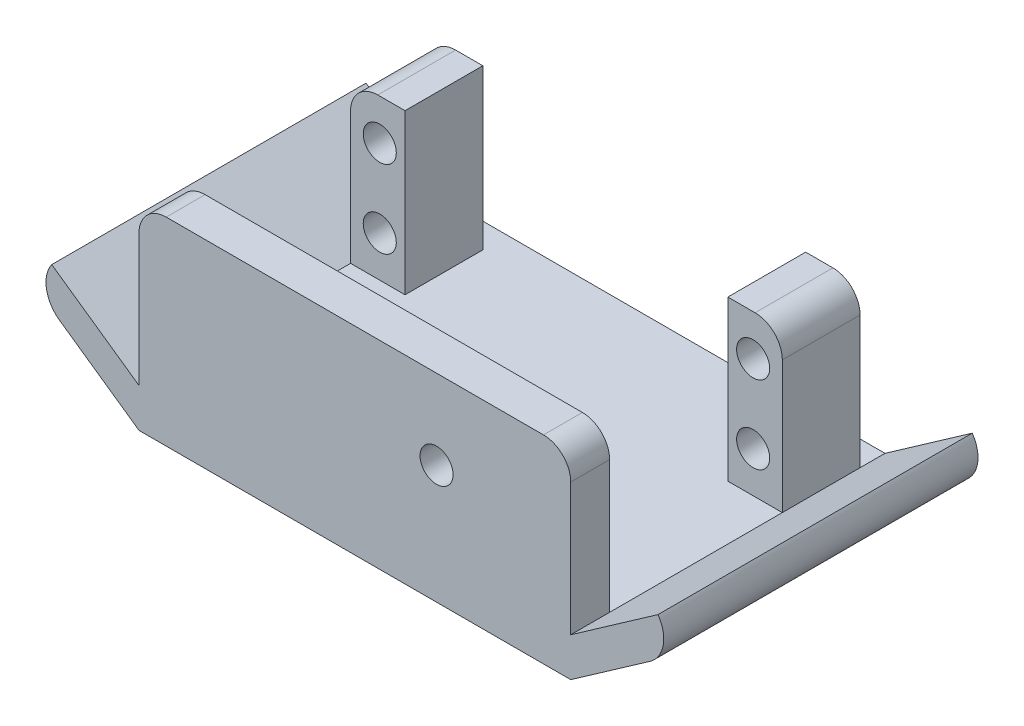
from build123d import *

# Parameters (mm, degrees)
SKETCH1_W            = 55.5
SKETCH1_H            = 40.4
BASE_DEPTH           = 5
SKETCH2_W            = 55.5
SKETCH2_H            = 25.5
WALL_DEPTH           = 5
SKETCH3_W            = 7
SKETCH3_H            = 20.5
MOUNTINGTABS_DEPTH   = 5
LIPS_REACH           = 75.23
SKETCH5_R            = 2.125
MOUNTINGHOLES_DEPTH  = 5
FILLETS_R            = 3.5
SKETCH6_R            = 2.125
THROUGHHOLE_DEPTH    = 5
FILLETS_OF_MIRROR3_R = 3.5
SKETCH7_W            = 104.516790574
SKETCH7_H            = 66.327963249
CUT_EXTRUDE1_DEPTH   = 73
SKETCH8_R            = 2.125
BOSS_EXTRUDE1_DEPTH  = 5


with BuildPart() as part:
    # Sketch1 → base (new body)
    with BuildSketch(Plane(origin=(0, 0, 0), x_dir=(1, 0, 0), z_dir=(0, 1, 0))):
        with Locations((27.75, 20.2)):
            Rectangle(SKETCH1_W, SKETCH1_H)
    base = extrude(amount=BASE_DEPTH)

    # Sketch2 → wall (add)
    with BuildSketch(Plane(origin=(0, 0, -40.4), x_dir=(-1, 0, 0), z_dir=(0, 0, -1))):
        with Locations((-27.75, 12.75)):
            Rectangle(SKETCH2_W, SKETCH2_H)
    wall = extrude(amount=-WALL_DEPTH)

    # Sketch3 → mountingTabs (add)
    with BuildSketch(Plane.XY.offset(-8.2)):
        with Locations((3.5, 15.25)):
            Rectangle(SKETCH3_W, SKETCH3_H)
        with Locations((52, 15.25)):
            Rectangle(SKETCH3_W, SKETCH3_H)
    mountingtabs = extrude(amount=MOUNTINGTABS_DEPTH)

    # lips: up to this face of the body (flat: up to its plane)
    lips_end = Plane(part.part.faces().sort_by_distance((27.75, 12.75, -40.4))[0])
    # Sketch4 → lips (add, up to the picked face)
    with BuildSketch(Plane.XY, mode=Mode.PRIVATE) as lips_sk1:
        with BuildLine():
            Line((0, 0), (-10.208884478, 7.148337868))
            ThreePointArc((-10.208884478, 7.148337868), (-11.894564223, 9.792816133), (-11.218174515, 12.85505036))
            Line((-11.218174515, 12.85505036), (0, 5))
            Line((0, 5), (0, 0))
        make_face()
    lips_tool1 = split(extrude(lips_sk1.sketch, amount=-LIPS_REACH, mode=Mode.PRIVATE), bisect_by=lips_end, keep=Keep.BOTH, mode=Mode.PRIVATE)
    # Sketch4 → lips (add, up to the picked face)
    with BuildSketch(Plane.XY, mode=Mode.PRIVATE) as lips_sk2:
        with BuildLine():
            Line((55.5, 5), (66.718174515, 12.85505036))
            ThreePointArc((66.718174515, 12.85505036), (67.394564223, 9.792816133), (65.708884478, 7.148337868))
            Line((65.708884478, 7.148337868), (55.5, 0))
            Line((55.5, 0), (55.5, 5))
        make_face()
    lips_tool2 = split(extrude(lips_sk2.sketch, amount=-LIPS_REACH, mode=Mode.PRIVATE), bisect_by=lips_end, keep=Keep.BOTH, mode=Mode.PRIVATE)
    lips_1 = lips_tool1.solids().sort_by(Axis((-5.839287, 6.590277, 0), (0, 0, -1)))[0]
    add(lips_1)
    lips_2 = lips_tool2.solids().sort_by(Axis((61.339287, 6.590277, 0), (0, 0, -1)))[0]
    add(lips_2)
    lips = lips_1 + lips_2  # lips as one shape, for the pattern or mirror that repeats it

    # Sketch5 → mountingHoles (cut)
    with BuildSketch(Plane.XY.offset(-3.2)):
        with Locations((3.75, 20.25)):
            Circle(SKETCH5_R)
        with Locations(Location((3.75, 10.25, 0), (0, 0, 180))):
            Circle(SKETCH5_R)
        with Locations((51.75, 10.25)):
            Circle(SKETCH5_R)
        with Locations(Location((51.75, 20.25, 0), (0, 0, 180))):
            Circle(SKETCH5_R)
    mountingholes = extrude(amount=-MOUNTINGHOLES_DEPTH, mode=Mode.SUBTRACT)

    # fillets
    fillets_edges = [part.edges().sort_by_distance(p)[0] for p in [
        (0, 25.5, -37.9),
        (55.5, 25.5, -37.9),
        (0, 25.5, -5.7),
        (55.5, 25.5, -5.7),
    ]]
    fillet(fillets_edges, radius=FILLETS_R)

    # Sketch6 → throughHole (cut)
    with BuildSketch(Plane.XY.offset(-35.4)):
        with Locations((38.25, 15.25)):
            Circle(SKETCH6_R)
    throughhole = extrude(amount=-THROUGHHOLE_DEPTH, mode=Mode.SUBTRACT)

    # Mirror3: base, wall, mountingTabs, lips, mountingHoles, throughHole across plane
    add(base.mirror(Plane.XY))
    add(wall.mirror(Plane.XY))
    add(mountingtabs.mirror(Plane.XY))
    add(lips.mirror(Plane.XY))
    add(mountingholes.mirror(Plane.XY), mode=Mode.SUBTRACT)
    add(throughhole.mirror(Plane.XY), mode=Mode.SUBTRACT)

    # fillets of Mirror3
    fillets_of_mirror3_edges = [part.edges().sort_by_distance(p)[0] for p in [
        (0, 25.5, 37.9),
        (55.5, 25.5, 37.9),
        (0, 25.5, 5.7),
        (55.5, 25.5, 5.7),
    ]]
    fillet(fillets_of_mirror3_edges, radius=FILLETS_OF_MIRROR3_R)

    # Sketch7 → Cut-Extrude1 (cut)
    with BuildSketch(Plane.XY):
        with Locations((25.489671827, 15.622702088)):
            Rectangle(SKETCH7_W, SKETCH7_H)
    extrude(amount=-CUT_EXTRUDE1_DEPTH, mode=Mode.SUBTRACT)

    # Sketch8 → Boss-Extrude1 (add)
    # profile 1 of 2: a face of its own
    with BuildSketch(Plane.XY.offset(8.2)):
        with BuildLine():
            Line((7, 25.5), (3.5, 25.5))
            ThreePointArc((3.5, 25.5), (1.025126266, 24.474873734), (0, 22))
            Line((0, 22), (0, 5))
            Line((0, 5), (7, 5))
            Line((7, 5), (7, 25.5))
        make_face()
        with Locations((3.75, 20.25)):
            Circle(SKETCH8_R, mode=Mode.SUBTRACT)
        with Locations(Location((3.75, 10.25, 0), (0, 0, 180))):
            Circle(SKETCH8_R, mode=Mode.SUBTRACT)
    # profile 2 of 2: a face of its own
    with BuildSketch(Plane.XY.offset(8.2)):
        with BuildLine():
            Line((55.5, 5), (55.5, 22))
            ThreePointArc((55.5, 22), (54.474873734, 24.474873734), (52, 25.5))
            Line((52, 25.5), (48.5, 25.5))
            Line((48.5, 25.5), (48.5, 5))
            Line((48.5, 5), (55.5, 5))
        make_face()
        with Locations(Location((51.75, 20.25, 0), (0, 0, 180))):
            Circle(SKETCH8_R, mode=Mode.SUBTRACT)
        with Locations((51.75, 10.25)):
            Circle(SKETCH8_R, mode=Mode.SUBTRACT)
    extrude(amount=BOSS_EXTRUDE1_DEPTH)


solid = part.part
